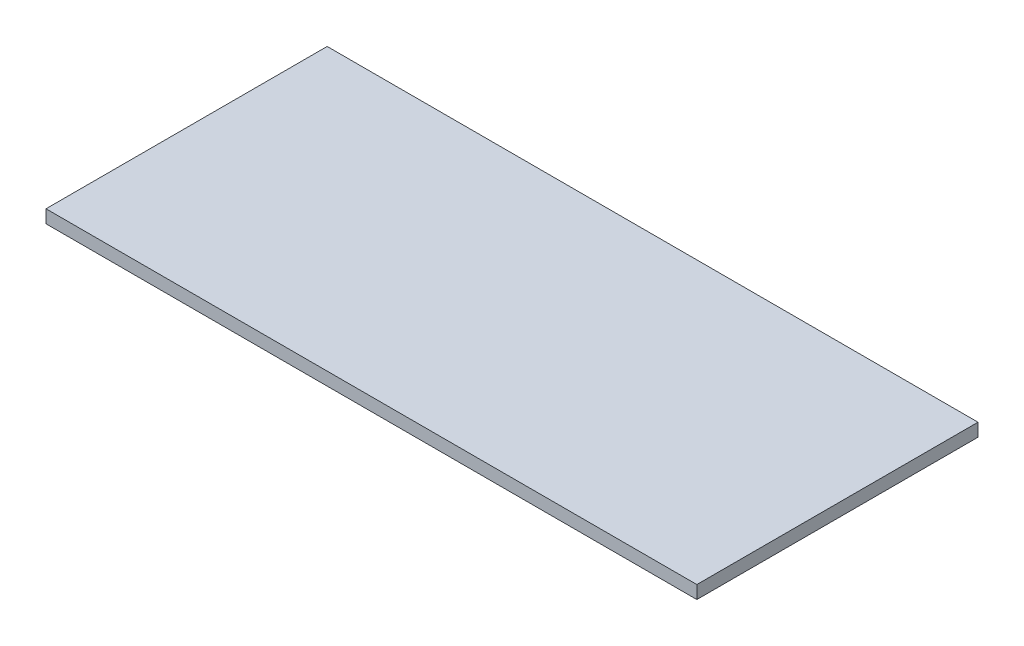
from build123d import *

# Parameters (mm, degrees)
SCHIZZO1_W                   = 2500
SCHIZZO1_H                   = 1080
ESTRUSIONE_ESTRUSIONE1_DEPTH = 50


with BuildPart() as part:
    # Schizzo1 → Estrusione-Estrusione1 (new body)
    with BuildSketch(Plane(origin=(0, 0, 0), x_dir=(1, 0, 0), z_dir=(0, 1, 0))):
        Rectangle(SCHIZZO1_W, SCHIZZO1_H)
    extrude(amount=ESTRUSIONE_ESTRUSIONE1_DEPTH)


solid = part.part
